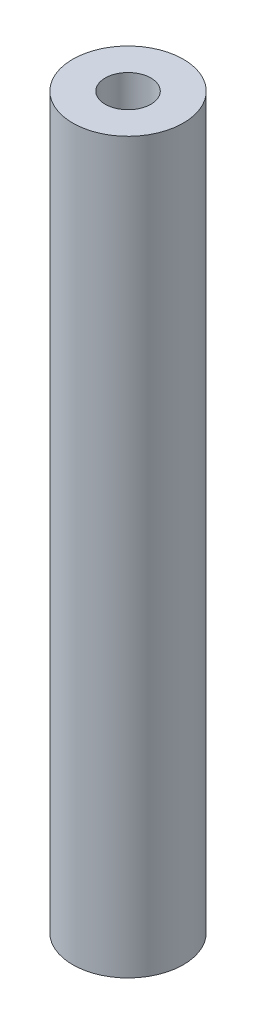
from build123d import *

# Parameters (mm, degrees)
SKETCH1_R                 = 4
BOSS_EXTRUDE1_DEPTH       = 26.35
M4X0_7_TAPPED_HOLE1_D     = 3.3
M4X0_7_TAPPED_HOLE1_DEPTH = 15
M4X0_7_TAPPED_HOLE1_TIP   = 0.991420021
M4X0_7_TAPPED_HOLE2_D     = 3.3
M4X0_7_TAPPED_HOLE2_DEPTH = 15
M4X0_7_TAPPED_HOLE2_TIP   = 0.991420021


with BuildPart() as part:
    # Sketch1 → Boss-Extrude1 (new, symmetric)
    with BuildSketch(Plane(origin=(0, 0, 0), x_dir=(1, 0, 0), z_dir=(0, 1, 0))):
        with Locations(Location((0, 0, 0), (0, 0, 90))):
            Circle(SKETCH1_R)
    extrude(amount=BOSS_EXTRUDE1_DEPTH, both=True)

    # M4x0.7 Tapped Hole1
    with Locations(Plane(origin=(0, 26.35, 0), x_dir=(1, 0, 0), z_dir=(0, 1, 0))):
        with Locations((0, 0)):
            Hole(M4X0_7_TAPPED_HOLE1_D / 2, depth=M4X0_7_TAPPED_HOLE1_DEPTH)
            with Locations((0, 0, -(M4X0_7_TAPPED_HOLE1_DEPTH + M4X0_7_TAPPED_HOLE1_TIP / 2))):  # 118° drill point
                Cone(0, M4X0_7_TAPPED_HOLE1_D / 2, M4X0_7_TAPPED_HOLE1_TIP, mode=Mode.SUBTRACT)

    # M4x0.7 Tapped Hole2
    with Locations(Plane(origin=(0, -26.35, 0), x_dir=(-1, 0, 0), z_dir=(0, -1, 0))):
        with Locations((0, 0)):
            Hole(M4X0_7_TAPPED_HOLE2_D / 2, depth=M4X0_7_TAPPED_HOLE2_DEPTH)
            with Locations((0, 0, -(M4X0_7_TAPPED_HOLE2_DEPTH + M4X0_7_TAPPED_HOLE2_TIP / 2))):  # 118° drill point
                Cone(0, M4X0_7_TAPPED_HOLE2_D / 2, M4X0_7_TAPPED_HOLE2_TIP, mode=Mode.SUBTRACT)


solid = part.part
